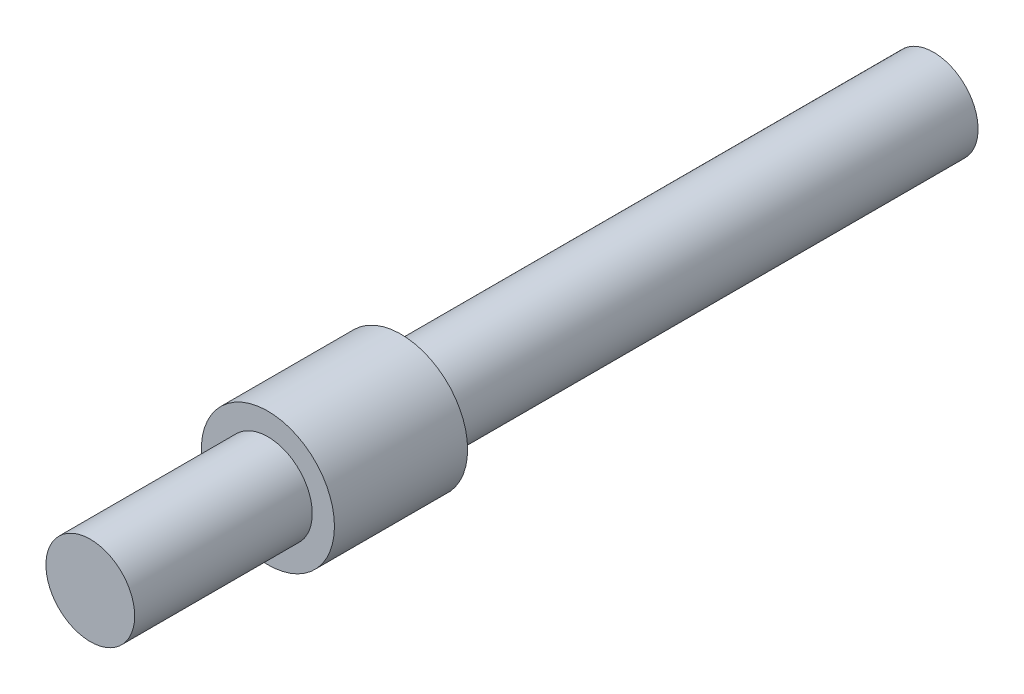
from build123d import *

# Parameters (mm, degrees)
SKETCH1_R           = 2
BOSS_EXTRUDE1_DEPTH = 24
SKETCH3_R           = 3
BOSS_EXTRUDE3_DEPTH = 9
BOSS_EXTRUDE4_START = 14
SKETCH4_R           = 2
BOSS_EXTRUDE4_DEPTH = 14
CUT_EXTRUDE1_START  = -3
SKETCH5_R           = 4
SKETCH5_R_2         = 2
CUT_EXTRUDE1_DEPTH  = 3


with BuildPart() as part:
    # Sketch1 → Boss-Extrude1 (new body)
    with BuildSketch(Plane.XY):
        Circle(SKETCH1_R)
    extrude(amount=BOSS_EXTRUDE1_DEPTH)

    # Sketch3 → Boss-Extrude3 (add)
    with BuildSketch(Plane.XY.offset(19)):
        Circle(SKETCH3_R)
    extrude(amount=-BOSS_EXTRUDE3_DEPTH)

    # Sketch4 → Boss-Extrude4 (add)
    with BuildSketch(Plane(origin=(0, 0, 0), x_dir=(-1, 0, 0), z_dir=(0, 0, -1)).offset(BOSS_EXTRUDE4_START)):
        Circle(SKETCH4_R)
    extrude(amount=-BOSS_EXTRUDE4_DEPTH)

    # Sketch5 → Cut-Extrude1 (cut)
    with BuildSketch(Plane.XY.offset(19).offset(CUT_EXTRUDE1_START)):
        Circle(SKETCH5_R)
        with Locations(Location((0, 0, 0), (0, 0, 180))):
            Circle(SKETCH5_R_2, mode=Mode.SUBTRACT)
    extrude(amount=CUT_EXTRUDE1_DEPTH, mode=Mode.SUBTRACT)


solid = part.part
